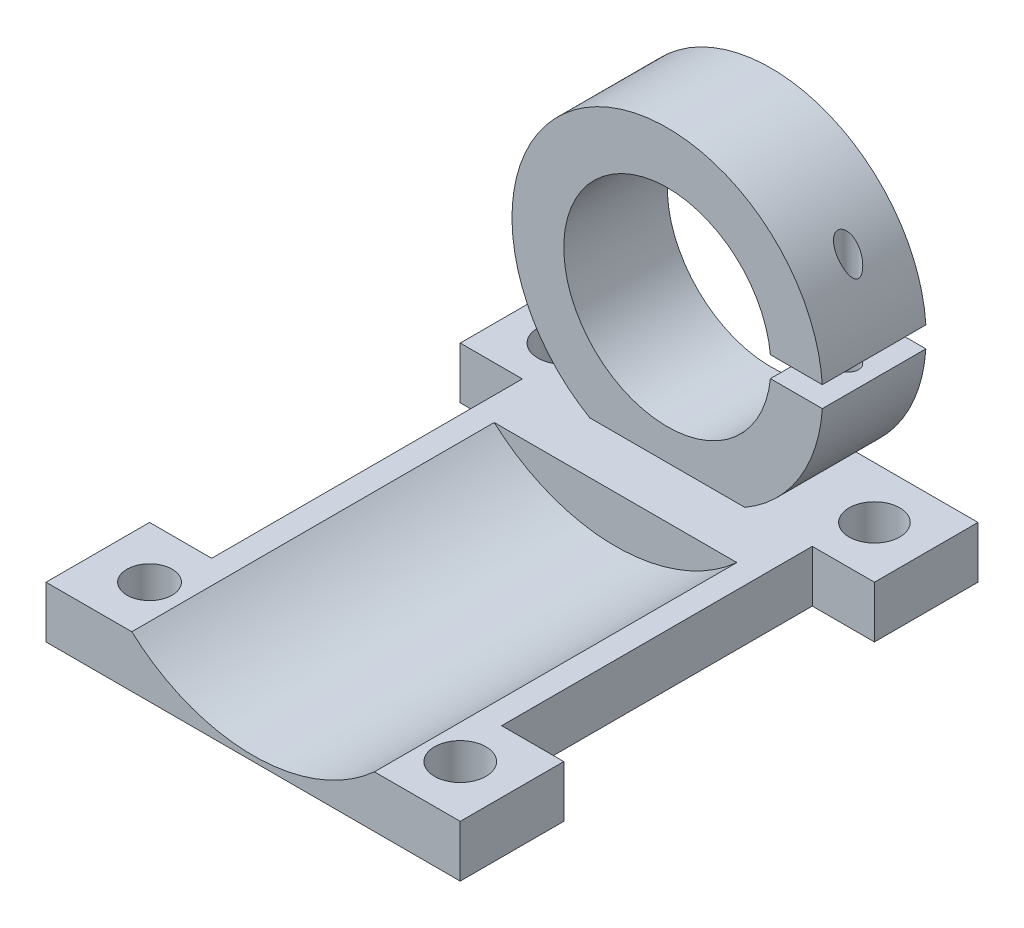
from build123d import *

# Parameters (mm, degrees)
SKETCH1_W               = 6
SKETCH1_H               = 10
SKETCH1_W_2             = 28
SKETCH1_H_2             = 50
BOSS_EXTRUDE1_DEPTH     = 5
BOSS_EXTRUDE2_DEPTH     = 10
SKETCH4_R               = 17.5
CUT_EXTRUDE1_DEPTH      = 35
CUT_EXTRUDE2_DEPTH      = 30
CUT_EXTRUDE2_DEPTH_BACK = 5
SKETCH6_R               = 1
SKETCH5_R               = 2.179957699
SKETCH5_R_2             = 2.482189609
SKETCH5_R_3             = 2.446214892
SKETCH5_R_4             = 2.511545909
CUT_EXTRUDE3_DEPTH      = 30


with BuildPart() as part:
    # Sketch1 → Boss-Extrude1 (new body)
    with BuildSketch(Plane(origin=(0, 0, 0), x_dir=(1, 0, 0), z_dir=(0, 1, 0))):
        with Locations((-17, -20)):
            Rectangle(SKETCH1_W, SKETCH1_H)
        Rectangle(SKETCH1_W_2, SKETCH1_H_2)
        with Locations((-17, 20)):
            Rectangle(SKETCH1_W, SKETCH1_H)
        with Locations((17, 20)):
            Rectangle(SKETCH1_W, SKETCH1_H)
        with Locations((17, -20)):
            Rectangle(SKETCH1_W, SKETCH1_H)
    extrude(amount=BOSS_EXTRUDE1_DEPTH)

    # Sketch2 → Boss-Extrude2 (add)
    with BuildSketch(Plane(origin=(0, 0, -25), x_dir=(-1, 0, 0), z_dir=(0, 0, -1))):
        with BuildLine():
            Line((-9.949874371, 19), (-14.966629547, 19))
            ThreePointArc((-14.966629547, 19), (15, 18), (-14.966629547, 17))
            Line((-14.966629547, 17), (-9.949874371, 17))
            ThreePointArc((-9.949874371, 17), (10, 18), (-9.949874371, 19))
        make_face()
    extrude(amount=-BOSS_EXTRUDE2_DEPTH)

    # Sketch4 → Cut-Extrude1 (cut)
    with BuildSketch(Plane.XY.offset(25)):
        with Locations((0, 18)):
            Circle(SKETCH4_R)
    extrude(amount=-CUT_EXTRUDE1_DEPTH, mode=Mode.SUBTRACT)

    # Sketch6 → Cut-Extrude2 (cut, two sides: drawn at the far end of the back side and taken through both)
    with BuildSketch(Plane(origin=(0, 17, 0), x_dir=(1, 0, 0), z_dir=(0, 1, 0)).offset(-CUT_EXTRUDE2_DEPTH_BACK)):
        with Locations(Location((12.458251959, 20, 0), (0, 0, 180))):
            Circle(SKETCH6_R)
    extrude(amount=CUT_EXTRUDE2_DEPTH + CUT_EXTRUDE2_DEPTH_BACK, mode=Mode.SUBTRACT)

    # Sketch5 → Cut-Extrude3 (cut)
    with BuildSketch(Plane(origin=(0, 5, 0), x_dir=(1, 0, 0), z_dir=(0, 1, 0))):
        with Locations(Location((-15, -20, 0), (0, 0, 270))):
            Circle(SKETCH5_R)
        with Locations(Location((15, -20, 0), (0, 0, 270))):
            Circle(SKETCH5_R_2)
        with Locations(Location((15, 20, 0), (0, 0, 270))):
            Circle(SKETCH5_R_3)
        with Locations(Location((-15, 20, 0), (0, 0, 270))):
            Circle(SKETCH5_R_4)
    extrude(amount=-CUT_EXTRUDE3_DEPTH, mode=Mode.SUBTRACT)


solid = part.part
